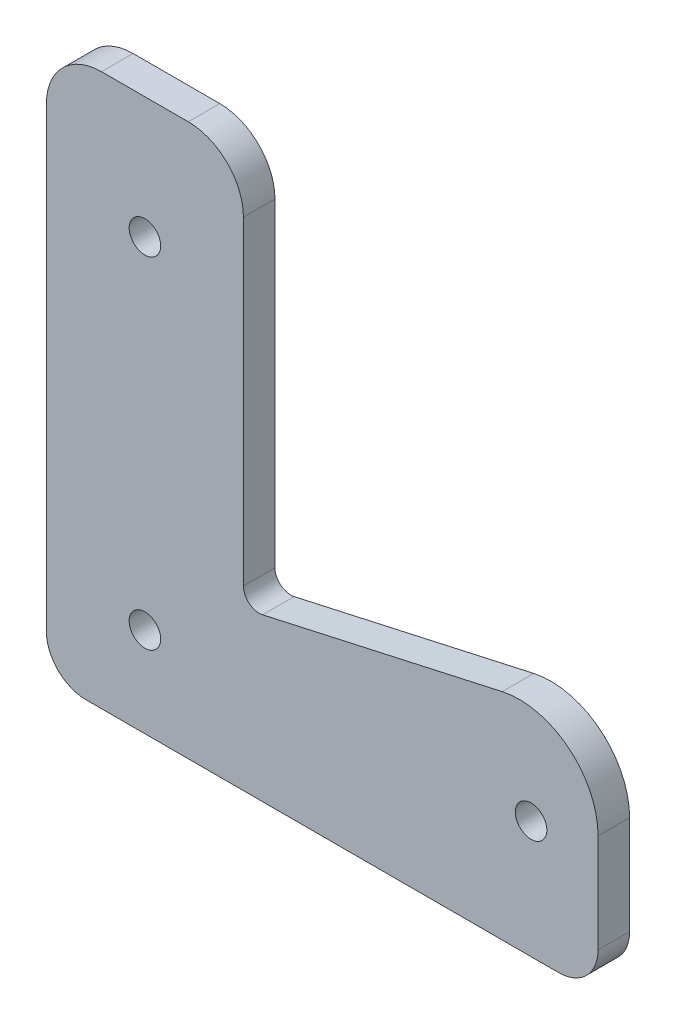
from build123d import *

# Parameters (mm, degrees)
SCHIZZO1_R                   = 2
ESTRUSIONE_ESTRUSIONE1_DEPTH = 4
RACCORDO1_R                  = 7
RACCORDO2_R                  = 5
RACCORDO3_R                  = 10
RACCORDO4_R                  = 2


with BuildPart() as part:
    # Schizzo1 → Estrusione-Estrusione1 (new body)
    with BuildSketch(Plane.XY):
        Polygon((0, 0), (0, 70), (25, 70), (25, 20), (70, 30), (70, 0), align=None)
        with Locations((12.5, 11.4)):
            Circle(SCHIZZO1_R, mode=Mode.SUBTRACT)
        with Locations((12.5, 54.6)):
            Circle(SCHIZZO1_R, mode=Mode.SUBTRACT)
        with Locations((61.5, 14.9)):
            Circle(SCHIZZO1_R, mode=Mode.SUBTRACT)
    extrude(amount=ESTRUSIONE_ESTRUSIONE1_DEPTH)

    # Raccordo1
    raccordo1_edges = [part.edges().sort_by_distance(p)[0] for p in [
        (0, 70, 2),
        (25, 70, 2),
    ]]
    fillet(raccordo1_edges, radius=RACCORDO1_R)

    # Raccordo2
    raccordo2_edges = [part.edges().sort_by_distance(p)[0] for p in [
        (0, 0, 2),
        (70, 0, 2),
    ]]
    fillet(raccordo2_edges, radius=RACCORDO2_R)

    # Raccordo3
    raccordo3_edges = [part.edges().sort_by_distance(p)[0] for p in [
        (70, 30, 2),
    ]]
    fillet(raccordo3_edges, radius=RACCORDO3_R)

    # Raccordo4
    raccordo4_edges = [part.edges().sort_by_distance(p)[0] for p in [
        (25, 20, 2),
    ]]
    fillet(raccordo4_edges, radius=RACCORDO4_R)


solid = part.part
